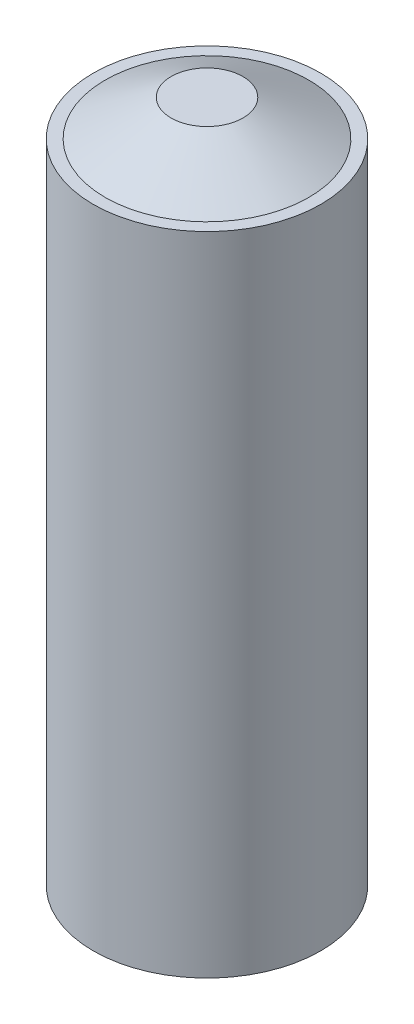
from build123d import *


with BuildPart() as part:
    # Sketch1 → Revolve1 (revolve)
    with BuildSketch(Plane.XY, mode=Mode.PRIVATE) as revolve1_sk:
        Polygon((19, 54), (19, -54), (17, -54), (6, -60), (0, -60), (0, 60), (6, 60), (17, 54), align=None)
    revolve(revolve1_sk.sketch.rotate(Axis((0, 60, 0), (0, -1, 0)), 90), axis=Axis((0, 60, 0), (0, -1, 0)))


solid = part.part
